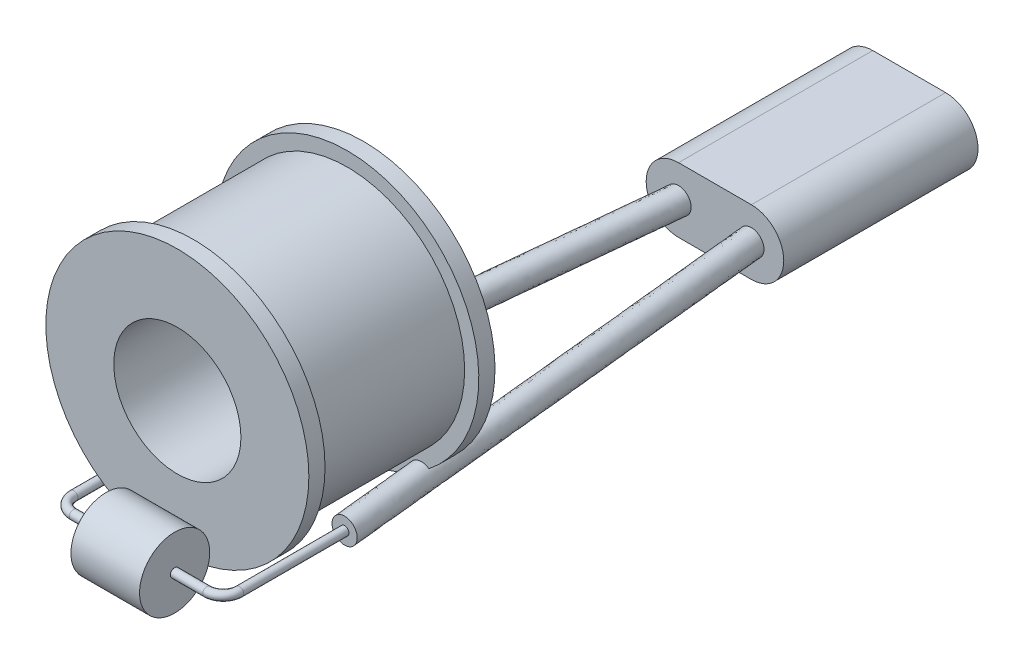
from build123d import *

# Parameters (mm, degrees)
SKETCH1_R                = 16.25
BOSS_EXTRUDE1_DEPTH      = 2
SKETCH2_R                = 14.5
BOSS_EXTRUDE2_DEPTH      = 19
SKETCH3_R                = 16.25
BOSS_EXTRUDE3_DEPTH      = 2
SKETCH4_R                = 7.855
CUT_EXTRUDE1_DEPTH       = 33.513458752
BOSS_EXTRUDE4_DEPTH      = 4.24
BOSS_EXTRUDE4_DEPTH_BACK = 4.24
SKETCH5_R                = 4.335
SKETCH7_R                = 0.535
SKETCH9_R                = 0.535
SKETCH11_R               = 1.555
SKETCH12_R               = 1.555
BOSS_EXTRUDE5_DEPTH      = 24


with BuildPart() as part:
    # Sketch1 → Boss-Extrude1 (new body)
    with BuildSketch(Plane.XY):
        Circle(SKETCH1_R)
    extrude(amount=BOSS_EXTRUDE1_DEPTH)

    # Sketch2 → Boss-Extrude2 (add)
    with BuildSketch(Plane.XY.offset(2)):
        Circle(SKETCH2_R)
    extrude(amount=BOSS_EXTRUDE2_DEPTH)

    # Sketch3 → Boss-Extrude3 (add)
    with BuildSketch(Plane.XY.offset(21)):
        Circle(SKETCH3_R)
    extrude(amount=BOSS_EXTRUDE3_DEPTH)

    # Sketch4 → Cut-Extrude1 (cut, through all)
    with BuildSketch(Plane.XY.offset(23)):
        Circle(SKETCH4_R)
    extrude(amount=-CUT_EXTRUDE1_DEPTH, mode=Mode.SUBTRACT)



with BuildPart() as body_2:
    # Sketch5 → Boss-Extrude4 (new, two sides: drawn at the far end of the back side and taken through both)
    with BuildSketch(Plane(origin=(0, 0, 0), x_dir=(0, 0, -1), z_dir=(1, 0, 0)).offset(-BOSS_EXTRUDE4_DEPTH_BACK)):
        with Locations((-27.57326721, -14)):
            Circle(SKETCH5_R)
    extrude(amount=BOSS_EXTRUDE4_DEPTH + BOSS_EXTRUDE4_DEPTH_BACK)

    # Sweep2: sweep along a path in Sketch6
    with BuildLine(Plane(origin=(0, -14, 0), x_dir=(1, 0, 0), z_dir=(0, 1, 0))) as sweep2_path:
        Line((4.24, -27.57326721), (8.245, -27.57326721))
        ThreePointArc((8.245, -27.57326721), (9.659213562, -26.987480772), (10.245, -25.57326721))
        Line((10.245, -25.57326721), (10.245, -12.57326721))
    # Sketch7 → Sweep2 (sweep)
    with BuildSketch(Plane(origin=(4.24, 0, 0), x_dir=(0, 0, -1), z_dir=(1, 0, 0))):
        with Locations((-27.57326721, -14)):
            Circle(SKETCH7_R)
    sweep(path=sweep2_path.line)

    # Sweep6: sweep along a path in Sketch6<5>
    with BuildLine(Plane(origin=(0, -14, 0), x_dir=(1, 0, 0), z_dir=(0, 1, 0))) as sweep6_path:
        Line((-4.24, -27.57326721), (-8.245, -27.57326721))
        ThreePointArc((-8.245, -27.57326721), (-9.659213562, -26.987480772), (-10.245, -25.57326721))
        Line((-10.245, -25.57326721), (-10.245, -12.57326721))
    # Sketch9 → Sweep6 (sweep)
    with BuildSketch(Plane.ZY.offset(4.24)):
        with Locations((27.57326721, -14)):
            Circle(SKETCH9_R)
    sweep(path=sweep6_path.line)


with BuildPart() as part_1:
    add(part.part)

    add(body_2.part)  # Sweep7 merges body 2
    # Sweep7: sweep along a path in Sketch10
    with BuildLine(Plane(origin=(0, -14, 0), x_dir=(1, 0, 0), z_dir=(0, 1, 0))) as sweep7_path:
        Line((-10.245, -12.57326721), (-4.5, 43.42673279))
    # Sketch11 → Sweep7 (sweep)
    with BuildSketch(Plane(origin=(0, 0, 12.57326721), x_dir=(-1, 0, 0), z_dir=(0, 0, -1))):
        with Locations((10.245, -14)):
            Circle(SKETCH11_R)
    sweep(path=sweep7_path.line)

    # Sweep14: sweep along a path in Sketch13
    with BuildLine(Plane(origin=(0, -14, 0), x_dir=(1, 0, 0), z_dir=(0, 1, 0))) as sweep14_path:
        Line((10.245, -12.57326721), (4.5, 43.42673279))
    # Sketch12 → Sweep14 (sweep)
    with BuildSketch(Plane(origin=(0, 0, 12.57326721), x_dir=(-1, 0, 0), z_dir=(0, 0, -1))):
        with Locations((-10.245, -14)):
            Circle(SKETCH12_R)
    sweep(path=sweep14_path.line)

    # Sketch14 → Boss-Extrude5 (add)
    with BuildSketch(Plane(origin=(0, 0, -43.42673279), x_dir=(-1, 0, 0), z_dir=(0, 0, -1))):
        with BuildLine():
            Line((4.5, -18), (-4.5, -18))
            ThreePointArc((-4.5, -18), (-8.5, -14), (-4.5, -10))
            Line((-4.5, -10), (4.5, -10))
            ThreePointArc((4.5, -10), (8.5, -14), (4.5, -18))
        make_face()
    extrude(amount=BOSS_EXTRUDE5_DEPTH)


solid = part_1.part
